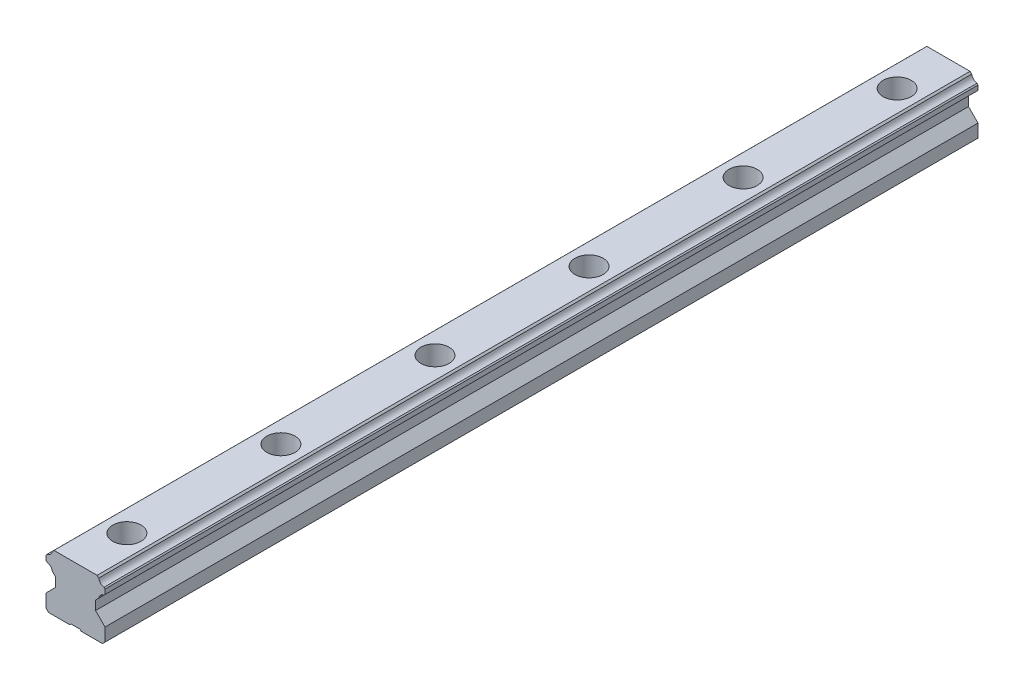
from build123d import *

# Parameters (mm, degrees)
EXTRUDE1_DEPTH  = 340
LPATTERN1_COUNT = 6
LPATTERN1_PITCH = 60


with BuildPart() as part:
    # Sketch1 → Extrude1 (new body)
    with BuildSketch(Plane(origin=(-20, 0, 0), x_dir=(1, 0, 0), z_dir=(0, 0, 1))):
        with BuildLine():
            Line((8.5, 18.910271646), (8.5, 17.079302786))
            Line((8.5, 17.079302786), (8.908405711, 16.67089517))
            ThreePointArc((8.908405711, 16.67089517), (10.269774971, 15.975032022), (10.964333487, 14.612996689))
            Line((10.964333487, 14.612996689), (12.197979513, 13.379350662))
            Line((12.197979513, 13.379350662), (12.197979513, 9.800170422))
            Line((12.197979513, 9.800170422), (8.5, 6.10021925))
            Line((8.5, 6.10021925), (8.5, 1))
            Line((8.5, 1), (9.5, 0))
            Line((9.5, 0), (17.75, 0))
            Line((17.75, 0), (18.25, 0.5))
            Line((18.25, 0.5), (21.75, 0.5))
            Line((21.75, 0.5), (22.25, 0))
            Line((22.25, 0), (30.5, 0))
            Line((30.5, 0), (31.5, 1))
            Line((31.5, 1), (31.5, 6.10021925))
            Line((31.5, 6.10021925), (27.802020487, 9.800170422))
            Line((27.802020487, 9.800170422), (27.802020487, 13.379350662))
            Line((27.802020487, 13.379350662), (29.035666513, 14.612996689))
            ThreePointArc((29.035666513, 14.612996689), (29.730225029, 15.975032022), (31.091594289, 16.67089517))
            Line((31.091594289, 16.67089517), (31.5, 17.079302786))
            Line((31.5, 17.079302786), (31.5, 18.910271646))
            Line((31.5, 18.910271646), (31.091594289, 19.330832529))
            ThreePointArc((31.091594289, 19.330832529), (29.733913517, 20.021041613), (29.035666513, 21.374606084))
            Line((29.035666513, 21.374606084), (28.410271644, 22))
            Line((28.410271644, 22), (11.589728356, 22))
            Line((11.589728356, 22), (10.964333487, 21.374606084))
            ThreePointArc((10.964333487, 21.374606084), (10.266086483, 20.021041613), (8.908405711, 19.330832529))
            Line((8.908405711, 19.330832529), (8.5, 18.910271646))
        make_face()
    extrude(amount=-EXTRUDE1_DEPTH)

    # Sketch2 → Cut-Revolve1 (revolve, cut)
    with BuildSketch(Plane(origin=(0, 0, 0), x_dir=(0, 0, -1), z_dir=(1, 0, 0))):
        Polygon((20, 22), (25.5, 22), (25.5, 13), (23.5, 13), (23.5, 0), (20, 0), align=None)
    cut_revolve1 = revolve(axis=Axis((0, 0, -20), (0, 1, 0)), mode=Mode.SUBTRACT)

    # LPattern1: Cut-Revolve1 ×6
    with Locations(*[(0, 0, -i * LPATTERN1_PITCH) for i in range(1, LPATTERN1_COUNT)]):
        add(cut_revolve1, mode=Mode.SUBTRACT)


solid = part.part
